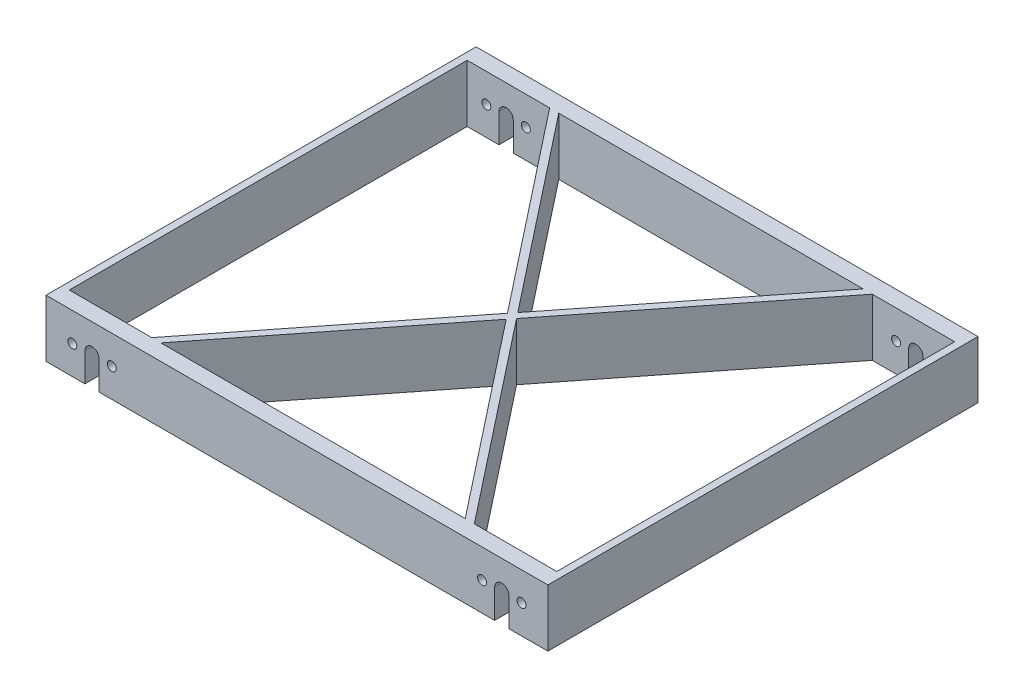
from build123d import *

# Parameters (mm, degrees)
SKETCH1_W           = 140
SKETCH1_H           = 120
SKETCH1_W_2         = 136
SKETCH1_H_2         = 111
BOSS_EXTRUDE1_DEPTH = 16
SKETCH2_R           = 1.25
CUT_EXTRUDE1_DEPTH  = 140.842768851


with BuildPart() as part:
    # Sketch1 → Boss-Extrude1 (new body)
    # profile 1 of 2: a face of its own
    with BuildSketch(Plane(origin=(0, 0, 0), x_dir=(1, 0, 0), z_dir=(0, 1, 0))):
        Rectangle(SKETCH1_W, SKETCH1_H)
        Rectangle(SKETCH1_W_2, SKETCH1_H_2, mode=Mode.SUBTRACT)
    # profile 2 of 2: a face of its own
    with BuildSketch(Plane(origin=(0, 0, 0), x_dir=(1, 0, 0), z_dir=(0, 1, 0))):
        Polygon((-1.273083994, 0), (-45, -55.5), (-42.453832012, -55.5), (0, -1.615850559), (42.453832012, -55.5), (45, -55.5), (1.273083994, 0), (45, 55.5), (42.453832012, 55.5), (0, 1.615850559), (-42.453832012, 55.5), (-45, 55.5), align=None)
    extrude(amount=BOSS_EXTRUDE1_DEPTH)

    # Sketch2 → Cut-Extrude1 (cut, through all)
    with BuildSketch(Plane.XY.offset(60)):
        with BuildLine():
            ThreePointArc((-55.15, 8), (-57.15, 10), (-59.15, 8))
            Line((-59.15, 8), (-59.15, 0))
            Line((-59.15, 0), (-55.15, 0))
            Line((-55.15, 0), (-55.15, 8))
        make_face()
        with Locations((-51.65, 8)):
            Circle(SKETCH2_R)
        with Locations((-62.65, 8)):
            Circle(SKETCH2_R)
        with BuildLine():
            Line((55.15, 8), (55.15, 0))
            Line((55.15, 0), (59.15, 0))
            Line((59.15, 0), (59.15, 8))
            ThreePointArc((59.15, 8), (57.15, 10), (55.15, 8))
        make_face()
        with Locations((51.65, 8)):
            Circle(SKETCH2_R)
        with Locations((62.65, 8)):
            Circle(SKETCH2_R)
    extrude(amount=-CUT_EXTRUDE1_DEPTH, mode=Mode.SUBTRACT)


solid = part.part
